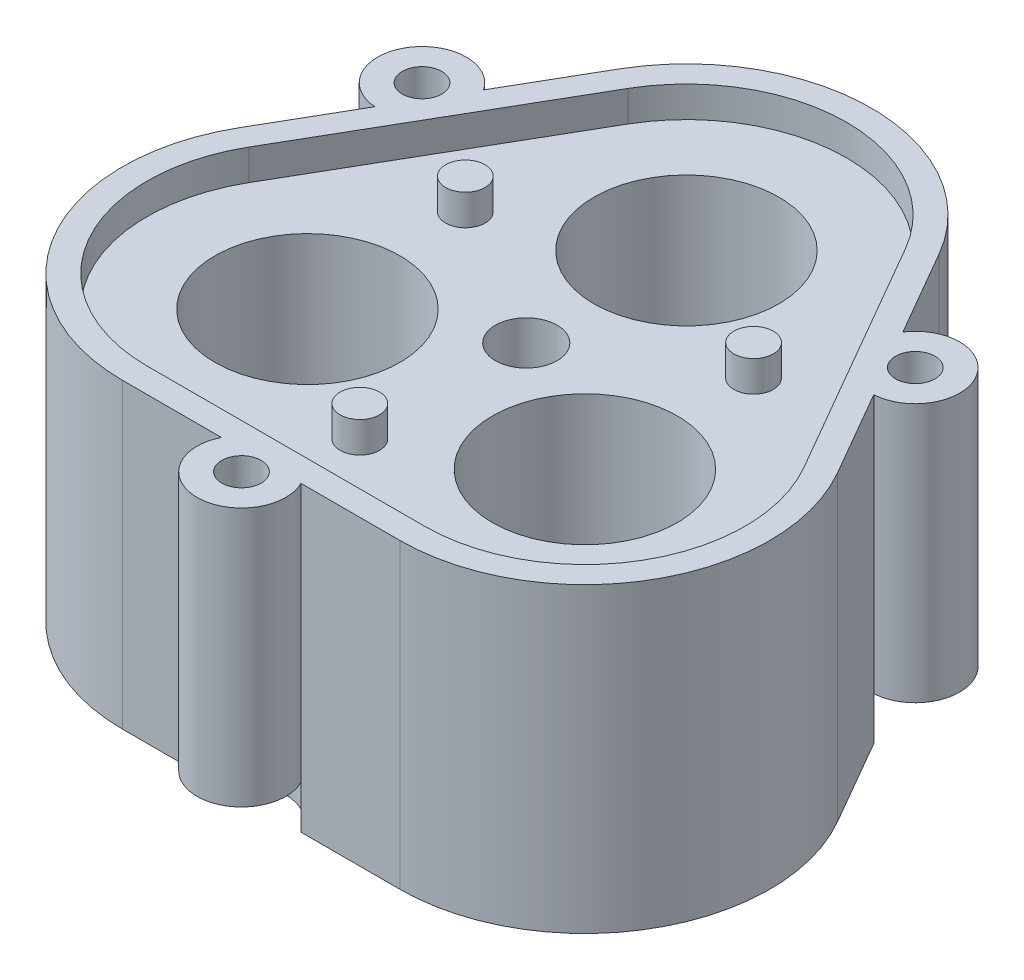
from build123d import *
from build123d.topology import SkipClean

# Parameters (mm, degrees)
SKETCH2_R               = 7.5
SKETCH2_R_2             = 2.5
BOSS_EXTRUDE1_DEPTH     = 12
BOSS_EXTRUDE2_START     = 8
SKETCH4_R               = 6
SKETCH4_R_2             = 2.5
BOSS_EXTRUDE2_DEPTH     = 8
SKETCH7_R               = 4
BOSS_EXTRUDE3_DEPTH     = 8
BOSS_EXTRUDE3_2_DEPTH   = 8
BOSS_EXTRUDE3_3_DEPTH   = 8
BOSS_EXTRUDE4_DEPTH     = 2
CUT_EXTRUDE2_DEPTH      = 61.285176544
CUT_EXTRUDE2_DEPTH_BACK = 61.285176544
SKETCH10_R              = 0.75
SKETCH10_R_2            = 2.5
CUT_EXTRUDE3_DEPTH      = 61.977885425
CUT_EXTRUDE3_DEPTH_BACK = 61.977885425
SKETCH12_R              = 57.284308747
CUT_EXTRUDE4_DEPTH      = 44.27266957
CUT_EXTRUDE4_DEPTH_BACK = 44.27266957
SKETCH15_R              = 1.6
BOSS_EXTRUDE5_START     = 2.5
SKETCH13_R              = 1.6
BOSS_EXTRUDE5_DEPTH     = 2.5
SKETCH16_R              = 3.6
SKETCH16_R_2            = 1.6
BOSS_EXTRUDE6_DEPTH     = 21
CUT_EXTRUDE10_START     = 3.5
SKETCH19_R              = 3.6
SKETCH19_R_2            = 1.6
CUT_EXTRUDE10_DEPTH     = 50.027727388
CIRPATTERN1_COUNT       = 3


with BuildPart() as part:
    # Sketch2 → Boss-Extrude1 (new body)
    with BuildSketch(Plane(origin=(0, 0, 0), x_dir=(1, 0, 0), z_dir=(0, 1, 0))):
        Polygon((-37.230762114, -21.495190528), (37.230762114, -21.495190528), (0, 42.990381057), align=None)
        with Locations(Location((0, 12.990381057, 0), (0, 0, 270))):
            Circle(SKETCH2_R, mode=Mode.SUBTRACT)
        with Locations(Location((-11.25, -6.495190528, 0), (0, 0, 270))):
            Circle(SKETCH2_R, mode=Mode.SUBTRACT)
        with Locations(Location((11.25, -6.495190528, 0), (0, 0, 270))):
            Circle(SKETCH2_R, mode=Mode.SUBTRACT)
        with Locations(Location((0, 0, 0), (0, 0, 270))):
            Circle(SKETCH2_R_2, mode=Mode.SUBTRACT)
    extrude(amount=BOSS_EXTRUDE1_DEPTH)

    # Sketch4 → Boss-Extrude2 (add)
    with SkipClean():  # the faces are left unmerged after this step: merging them gives an invalid solid
        with BuildSketch(Plane.XZ.offset(BOSS_EXTRUDE2_START)):
            Polygon((-37.230762114, 21.495190528), (37.230762114, 21.495190528), (0, -42.990381057), align=None)
            with Locations(Location((-11.25, 6.495190528, 0), (0, 0, 270))):
                Circle(SKETCH4_R, mode=Mode.SUBTRACT)
            with Locations(Location((11.25, 6.495190528, 0), (0, 0, 270))):
                Circle(SKETCH4_R, mode=Mode.SUBTRACT)
            with Locations(Location((0, -12.990381057, 0), (0, 0, 270))):
                Circle(SKETCH4_R, mode=Mode.SUBTRACT)
            with Locations(Location((0, 0, 0), (0, 0, 270))):
                Circle(SKETCH4_R_2, mode=Mode.SUBTRACT)
        extrude(amount=-BOSS_EXTRUDE2_DEPTH)



with BuildPart() as body_2:
    # Sketch7 → Boss-Extrude3 (new body)
    with BuildSketch(Plane(origin=(0, -8, 0), x_dir=(1, 0, 0), z_dir=(0, 1, 0))):
        with Locations(Location((0, 12.990381057, 0), (0, 0, 270))):
            Circle(SKETCH7_R)
    extrude(amount=BOSS_EXTRUDE3_DEPTH)


with BuildPart() as body_3:
    # Sketch7 → Boss-Extrude3 2 (new body)
    with BuildSketch(Plane(origin=(0, -8, 0), x_dir=(1, 0, 0), z_dir=(0, 1, 0))):
        with Locations(Location((-11.25, -6.495190528, 0), (0, 0, 270))):
            Circle(SKETCH7_R)
    extrude(amount=BOSS_EXTRUDE3_2_DEPTH)


with BuildPart() as body_4:
    # Sketch7 → Boss-Extrude3 3 (new body)
    with BuildSketch(Plane(origin=(0, -8, 0), x_dir=(1, 0, 0), z_dir=(0, 1, 0))):
        with Locations(Location((11.25, -6.495190528, 0), (0, 0, 270))):
            Circle(SKETCH7_R)
    extrude(amount=BOSS_EXTRUDE3_3_DEPTH)


with BuildPart() as part_1:
    with SkipClean():  # the faces are left unmerged after this step: merging them gives an invalid solid
        add(part.part)

        add(body_2.part)  # Boss-Extrude4 merges body 2

        add(body_3.part)  # Boss-Extrude4 merges body 3

        add(body_4.part)  # Boss-Extrude4 merges body 4
        # Sketch9 → Boss-Extrude4 (add)
        with BuildSketch(Plane(origin=(0, -8, 0), x_dir=(1, 0, 0), z_dir=(0, 1, 0))):
            Polygon((0, 42.990381057), (-37.230762114, -21.495190528), (37.230762114, -21.495190528), align=None)
        extrude(amount=-BOSS_EXTRUDE4_DEPTH)

    # Sketch10 → Cut-Extrude2 (cut, two sides: drawn at the far end of the back side and taken through both)
    with SkipClean():  # the faces are left unmerged after this step: merging them gives an invalid solid
        with BuildSketch(Plane(origin=(0, -8, 0), x_dir=(1, 0, 0), z_dir=(0, 1, 0)).offset(-CUT_EXTRUDE2_DEPTH_BACK)):
            with Locations(Location((-8.385990432, -2.3967214, 0), (0, 0, 270))):
                Circle(SKETCH10_R)
            with Locations(Location((-12.668631437, -1.700663978, 0), (0, 0, 270))):
                Circle(SKETCH10_R)
            with Locations(Location((-6.260007048, -6.17900967, 0), (0, 0, 270))):
                Circle(SKETCH10_R)
            with Locations(Location((-7.891590133, -10.199388575, 0), (0, 0, 270))):
                Circle(SKETCH10_R)
            with Locations(Location((-12.052124348, -11.430430799, 0), (0, 0, 270))):
                Circle(SKETCH10_R)
            with Locations(Location((-15.608642568, -8.945136439, 0), (0, 0, 270))):
                Circle(SKETCH10_R)
            with Locations(Location((-15.883014034, -4.614982838, 0), (0, 0, 270))):
                Circle(SKETCH10_R)
            with Locations(Location((2.117373598, 8.46084145, 0), (0, 0, 270))):
                Circle(SKETCH10_R)
            with Locations(Location((4.86149751, 11.821688644, 0), (0, 0, 270))):
                Circle(SKETCH10_R)
            with Locations(Location((-2.22117582, 8.510829966, 0), (0, 0, 270))):
                Circle(SKETCH10_R)
            with Locations(Location((-4.887134542, 11.934011819, 0), (0, 0, 270))):
                Circle(SKETCH10_R)
            with Locations(Location((-3.872981274, 16.152661254, 0), (0, 0, 270))):
                Circle(SKETCH10_R)
            with Locations(Location((0.057605887, 17.990049202, 0), (0, 0, 270))):
                Circle(SKETCH10_R)
            with Locations(Location((3.944814641, 16.062585062, 0), (0, 0, 270))):
                Circle(SKETCH10_R)
            with Locations(Location((6.268616834, -6.06412005, 0), (0, 0, 270))):
                Circle(SKETCH10_R)
            with Locations(Location((7.807133926, -10.121024667, 0), (0, 0, 270))):
                Circle(SKETCH10_R)
            with Locations(Location((8.481182868, -2.331820296, 0), (0, 0, 270))):
                Circle(SKETCH10_R)
            with Locations(Location((12.778724676, -1.734623244, 0), (0, 0, 270))):
                Circle(SKETCH10_R)
            with Locations(Location((15.925105622, -4.722230455, 0), (0, 0, 270))):
                Circle(SKETCH10_R)
            with Locations(Location((15.55103668, -9.044912763, 0), (0, 0, 270))):
                Circle(SKETCH10_R)
            with Locations(Location((11.938199393, -11.447602223, 0), (0, 0, 270))):
                Circle(SKETCH10_R)
            with Locations(Location((0, 0, 0), (0, 0, 270))):
                Circle(SKETCH10_R_2)
        extrude(amount=CUT_EXTRUDE2_DEPTH + CUT_EXTRUDE2_DEPTH_BACK, mode=Mode.SUBTRACT)

    # Sketch12 → Cut-Extrude3 (cut, two sides: drawn at the far end of the back side and taken through both)
    with SkipClean():  # the faces are left unmerged after this step: merging them gives an invalid solid
        with BuildSketch(Plane(origin=(0, 12, 0), x_dir=(1, 0, 0), z_dir=(0, 1, 0)).offset(-CUT_EXTRUDE3_DEPTH_BACK)):
            Circle(SKETCH12_R)
            with BuildLine():
                Line((-12.990381057, 20.490381057), (-24.240381057, 1.004809472))
                ThreePointArc((-24.240381057, 1.004809472), (-24.240381057, -13.995190528), (-11.25, -21.495190528))
                Line((-11.25, -21.495190528), (11.25, -21.495190528))
                ThreePointArc((11.25, -21.495190528), (24.240381057, -13.995190528), (24.240381057, 1.004809472))
                Line((24.240381057, 1.004809472), (12.990381057, 20.490381057))
                ThreePointArc((12.990381057, 20.490381057), (0, 27.990381057), (-12.990381057, 20.490381057))
            make_face(mode=Mode.SUBTRACT)
        extrude(amount=CUT_EXTRUDE3_DEPTH + CUT_EXTRUDE3_DEPTH_BACK, mode=Mode.SUBTRACT)

    # Sketch15 → Cut-Extrude4 (cut, two sides: drawn at the far end of the back side and taken through both)
    with SkipClean():  # the faces are left unmerged after this step: merging them gives an invalid solid
        with BuildSketch(Plane(origin=(0, -8, 0), x_dir=(1, 0, 0), z_dir=(0, 1, 0)).offset(-CUT_EXTRUDE4_DEPTH_BACK)):
            with Locations(Location((0, 12.990381057, 0), (0, 0, 270))):
                Circle(SKETCH15_R)
            with Locations(Location((-11.25, -6.495190528, 0), (0, 0, 270))):
                Circle(SKETCH15_R)
            with Locations(Location((11.25, -6.495190528, 0), (0, 0, 270))):
                Circle(SKETCH15_R)
        extrude(amount=CUT_EXTRUDE4_DEPTH + CUT_EXTRUDE4_DEPTH_BACK, mode=Mode.SUBTRACT)

    # Sketch13 → Boss-Extrude5 (add)
    # profile 1 of 4: a face of its own
    with BuildSketch(Plane(origin=(0, 12, 0), x_dir=(1, 0, 0), z_dir=(0, 1, 0)).offset(BOSS_EXTRUDE5_START)):
        with BuildLine():
            Line((-12.990381057, 20.490381057), (-24.240381057, 1.004809472))
            ThreePointArc((-24.240381057, 1.004809472), (-24.240381057, -13.995190528), (-11.25, -21.495190528))
            Line((-11.25, -21.495190528), (11.25, -21.495190528))
            ThreePointArc((11.25, -21.495190528), (24.240381057, -13.995190528), (24.240381057, 1.004809472))
            Line((24.240381057, 1.004809472), (12.990381057, 20.490381057))
            ThreePointArc((12.990381057, 20.490381057), (0, 27.990381057), (-12.990381057, 20.490381057))
        make_face()
        with BuildLine():
            ThreePointArc((11.258330249, 19.490381057), (0, 25.990381057), (-11.258330249, 19.490381057))
            Line((-11.258330249, 19.490381057), (-22.508330249, 0.004809472))
            ThreePointArc((-22.508330249, 0.004809472), (-22.508330249, -12.995190528), (-11.25, -19.495190528))
            Line((-11.25, -19.495190528), (11.25, -19.495190528))
            ThreePointArc((11.25, -19.495190528), (22.508330249, -12.995190528), (22.508330249, 0.004809472))
            Line((22.508330249, 0.004809472), (11.258330249, 19.490381057))
        make_face(mode=Mode.SUBTRACT)
    # profile 2 of 4: a face of its own
    with BuildSketch(Plane(origin=(0, 12, 0), x_dir=(1, 0, 0), z_dir=(0, 1, 0)).offset(BOSS_EXTRUDE5_START)):
        with Locations(Location((0, -13.495190528, 0), (0, 0, 270))):
            Circle(SKETCH13_R)
    # profile 3 of 4: a face of its own
    with BuildSketch(Plane(origin=(0, 12, 0), x_dir=(1, 0, 0), z_dir=(0, 1, 0)).offset(BOSS_EXTRUDE5_START)):
        with Locations(Location((11.687177826, 6.747595264, 0), (0, 0, 270))):
            Circle(SKETCH13_R)
    # profile 4 of 4: a face of its own
    with BuildSketch(Plane(origin=(0, 12, 0), x_dir=(1, 0, 0), z_dir=(0, 1, 0)).offset(BOSS_EXTRUDE5_START)):
        with Locations(Location((-11.687177826, 6.747595264, 0), (0, 0, 270))):
            Circle(SKETCH13_R)
    extrude(amount=-BOSS_EXTRUDE5_DEPTH)

    # Sketch16 → Boss-Extrude6 (add)
    # profile 1 of 3: a face of its own
    with BuildSketch(Plane(origin=(0, 14.5, 0), x_dir=(1, 0, 0), z_dir=(0, 1, 0))):
        with Locations((-20.001021703, 11.547595264)):
            Circle(SKETCH16_R)
        with Locations(Location((-20.001021703, 11.547595264, 0), (0, 0, 270))):
            Circle(SKETCH16_R_2, mode=Mode.SUBTRACT)
    # profile 2 of 3: a face of its own
    with BuildSketch(Plane(origin=(0, 14.5, 0), x_dir=(1, 0, 0), z_dir=(0, 1, 0))):
        with Locations((20.001021703, 11.547595264)):
            Circle(SKETCH16_R)
        with Locations(Location((20.001021703, 11.547595264, 0), (0, 0, 270))):
            Circle(SKETCH16_R_2, mode=Mode.SUBTRACT)
    # profile 3 of 3: a face of its own
    with BuildSketch(Plane(origin=(0, 14.5, 0), x_dir=(1, 0, 0), z_dir=(0, 1, 0))):
        with Locations((0, -23.095190528)):
            Circle(SKETCH16_R)
        with Locations(Location((0, -23.095190528, 0), (0, 0, 270))):
            Circle(SKETCH16_R_2, mode=Mode.SUBTRACT)
    extrude(amount=-BOSS_EXTRUDE6_DEPTH)

    # Sketch19 → Cut-Extrude10 (cut)
    with BuildSketch(Plane(origin=(0, -10, 0), x_dir=(1, 0, 0), z_dir=(0, 1, 0)).offset(CUT_EXTRUDE10_START)):
        with Locations((20.001021703, 11.547595264)):
            Circle(SKETCH19_R)
        with Locations(Location((20.001021703, 11.547595264, 0), (0, 0, 270))):
            Circle(SKETCH19_R_2, mode=Mode.SUBTRACT)
    cut_extrude10 = extrude(amount=-CUT_EXTRUDE10_DEPTH, mode=Mode.SUBTRACT)

    # CirPattern1: Cut-Extrude10 ×3 about axis
    cirpattern1_axis = Axis((0, 0, 0), (0, 1, 0))
    for i in range(1, CIRPATTERN1_COUNT):
        add(cut_extrude10.rotate(cirpattern1_axis, i * 360 / CIRPATTERN1_COUNT), mode=Mode.SUBTRACT)


solid = part_1.part
